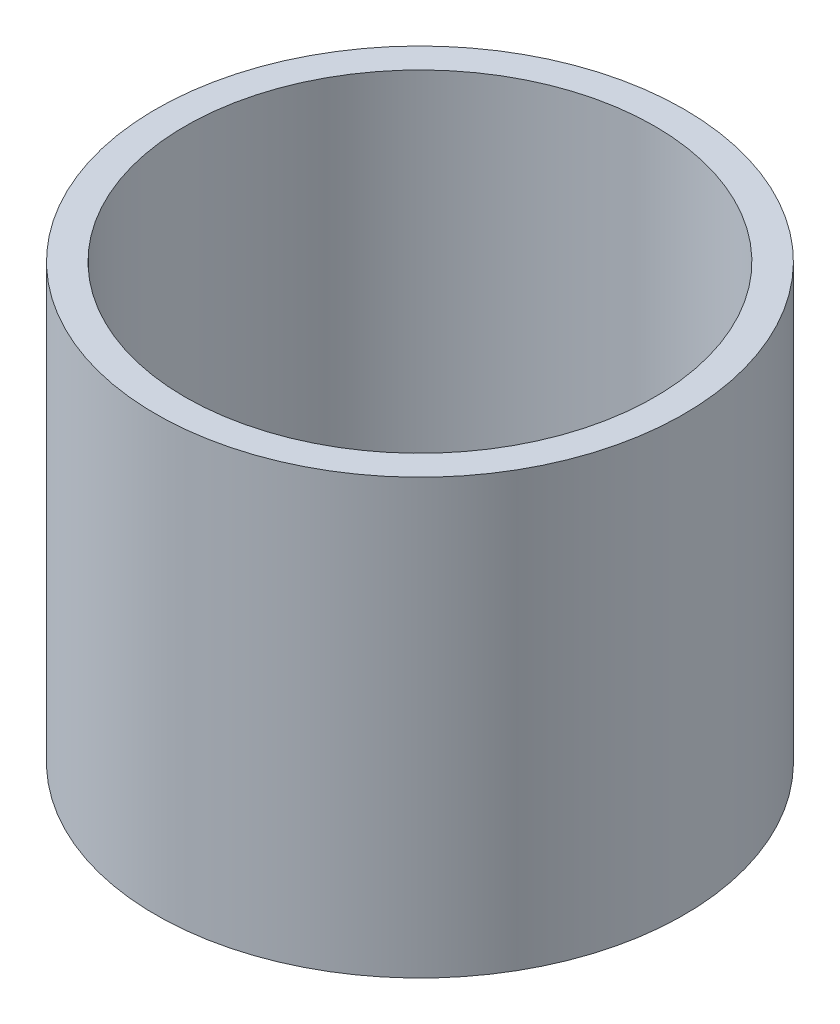
from build123d import *

# Parameters (mm, degrees)
SKETCH1_W = 1.5875
SKETCH1_H = 23.46500006


with BuildPart() as part:
    # Sketch1 → Revolve1 (revolve)
    with BuildSketch(Plane(origin=(0, 0, 0), x_dir=(0, 0, -1), z_dir=(1, 0, 0))):
        with Locations((13.49375, 11.73250003)):
            Rectangle(SKETCH1_W, SKETCH1_H)
    revolve(axis=Axis((0, 0, 0), (0, 1, 0)))


solid = part.part
